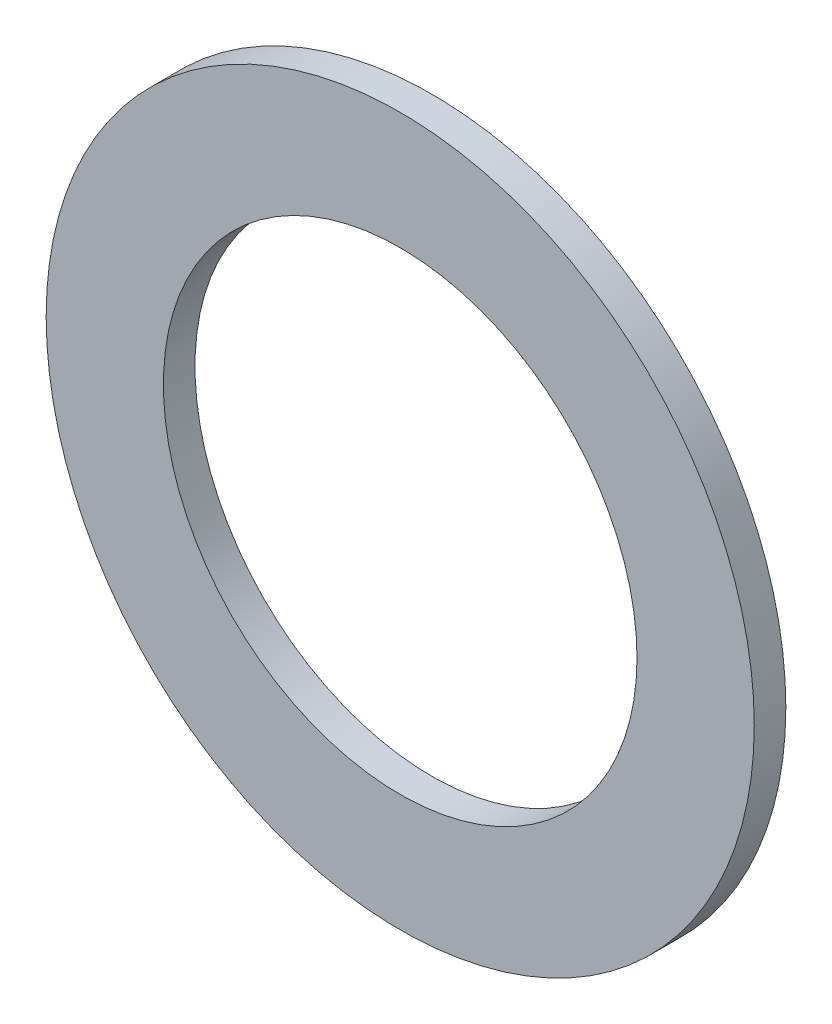
from build123d import *

# Parameters (mm, degrees)
SKETCH1_R           = 112.14
SKETCH1_R_2         = 75
BOSS_EXTRUDE1_DEPTH = 10


with BuildPart() as part:
    # Sketch1 → Boss-Extrude1 (new body)
    with BuildSketch(Plane.XY):
        Circle(SKETCH1_R)
        Circle(SKETCH1_R_2, mode=Mode.SUBTRACT)
    extrude(amount=-BOSS_EXTRUDE1_DEPTH)


solid = part.part
